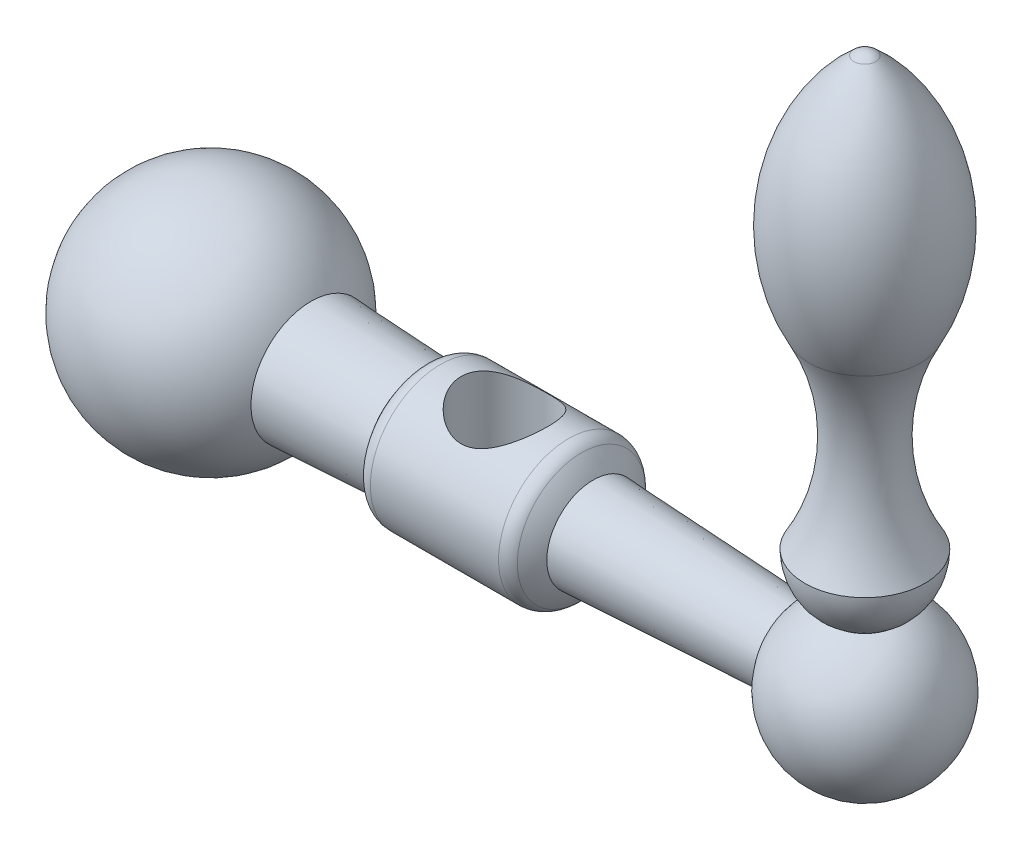
from build123d import *

# Parameters (mm, degrees)
KES_EKSTR_ZYON1_DEPTH      = 139.907343218
KES_EKSTR_ZYON1_DEPTH_BACK = 19
IZIM11_R                   = 6.5


with BuildPart() as part:
    # Çizim4 → Döndür2 (revolve)
    with BuildSketch(Plane.XY):
        with BuildLine():
            Line((17.5, 0), (-17.5, 0))
            ThreePointArc((-17.5, 0), (0, 17.5), (17.5, 0))
        make_face()
    revolve(axis=Axis((-17.5, 0, 0), (1, 0, 0)))



with BuildPart() as body_2:
    # Çizim6 → Döndür3 (revolve)
    with BuildSketch(Plane.XY, mode=Mode.PRIVATE) as d_nd_r3_sk:
        with BuildLine():
            Line((34.395313644, 10.5), (53.604686356, 10.5))
            ThreePointArc((53.604686356, 10.5), (54.665346528, 10.263846285), (55.525623627, 9.6))
            ThreePointArc((55.525623627, 9.6), (58.104686356, 5.104686356), (59, 0))
            Line((59, 0), (29, 0))
            ThreePointArc((29, 0), (29.895313644, 5.104686356), (32.474376373, 9.6))
            ThreePointArc((32.474376373, 9.6), (33.334653472, 10.263846285), (34.395313644, 10.5))
        make_face()
    revolve(d_nd_r3_sk.sketch.rotate(Axis((59, 0, 0), (-1, 0, 0)), 90), axis=Axis((59, 0, 0), (-1, 0, 0)))


with BuildPart() as body_3:
    # Çizim7 → Döndür4 (revolve)
    with BuildSketch(Plane.XY):
        with BuildLine():
            Line((86, 0), (110, 0))
            ThreePointArc((110, 0), (98, 12), (86, 0))
        make_face()
    revolve(axis=Axis((86, 0, 0), (1, 0, 0)))


with BuildPart() as part_1:
    add(part.part)

    add(body_2.part)  # Döndür5 merges body 2

    add(body_3.part)  # Döndür5 merges body 3
    # Çizim8 → Döndür5 (revolve)
    with BuildSketch(Plane.XY, mode=Mode.PRIVATE) as d_nd_r5_sk:
        with BuildLine():
            Line((15.00833102, 9), (87.334635496, 5.5))
            ThreePointArc((87.334635496, 5.5), (86.338431194, 2.82980794), (86, 0))
            Line((86, 0), (17.5, 0))
            ThreePointArc((17.5, 0), (16.865583193, 4.669272275), (15.00833102, 9))
        make_face()
    revolve(d_nd_r5_sk.sketch.rotate(Axis((86, 0, 0), (-1, 0, 0)), 180), axis=Axis((86, 0, 0), (-1, 0, 0)))

    # Çizim10 → Döndür6 (revolve)
    with BuildSketch(Plane.XY, mode=Mode.PRIVATE) as d_nd_r6_sk:
        with BuildLine():
            Line((98, 83), (98, 9.392026888))
            ThreePointArc((98, 9.392026888), (91.636038969, 12.028065858), (89, 18.392026888))
            ThreePointArc((89, 18.392026888), (92.993500576, 32.475023678), (89.599731438, 46.714446998))
            ThreePointArc((89.599731438, 46.714446998), (86.708723874, 65.750824244), (96.377409163, 82.401893523))
            ThreePointArc((96.377409163, 82.401893523), (97.135342209, 82.845712451), (98, 83))
        make_face()
    revolve(d_nd_r6_sk.sketch.rotate(Axis((98, 83, 0), (0, -1, 0)), 270), axis=Axis((98, 83, 0), (0, -1, 0)))

    # Çizim11 → Kes-Ekstrüzyon1 (cut, two sides: drawn at the far end of the back side and taken through both)
    with BuildSketch(Plane(origin=(0, 0, 0), x_dir=(1, 0, 0), z_dir=(0, 1, 0)).offset(-KES_EKSTR_ZYON1_DEPTH_BACK)):
        with Locations(Location((44, 0, 0), (0, 0, 90))):
            Circle(IZIM11_R)
    extrude(amount=KES_EKSTR_ZYON1_DEPTH + KES_EKSTR_ZYON1_DEPTH_BACK, mode=Mode.SUBTRACT)


solid = part_1.part
